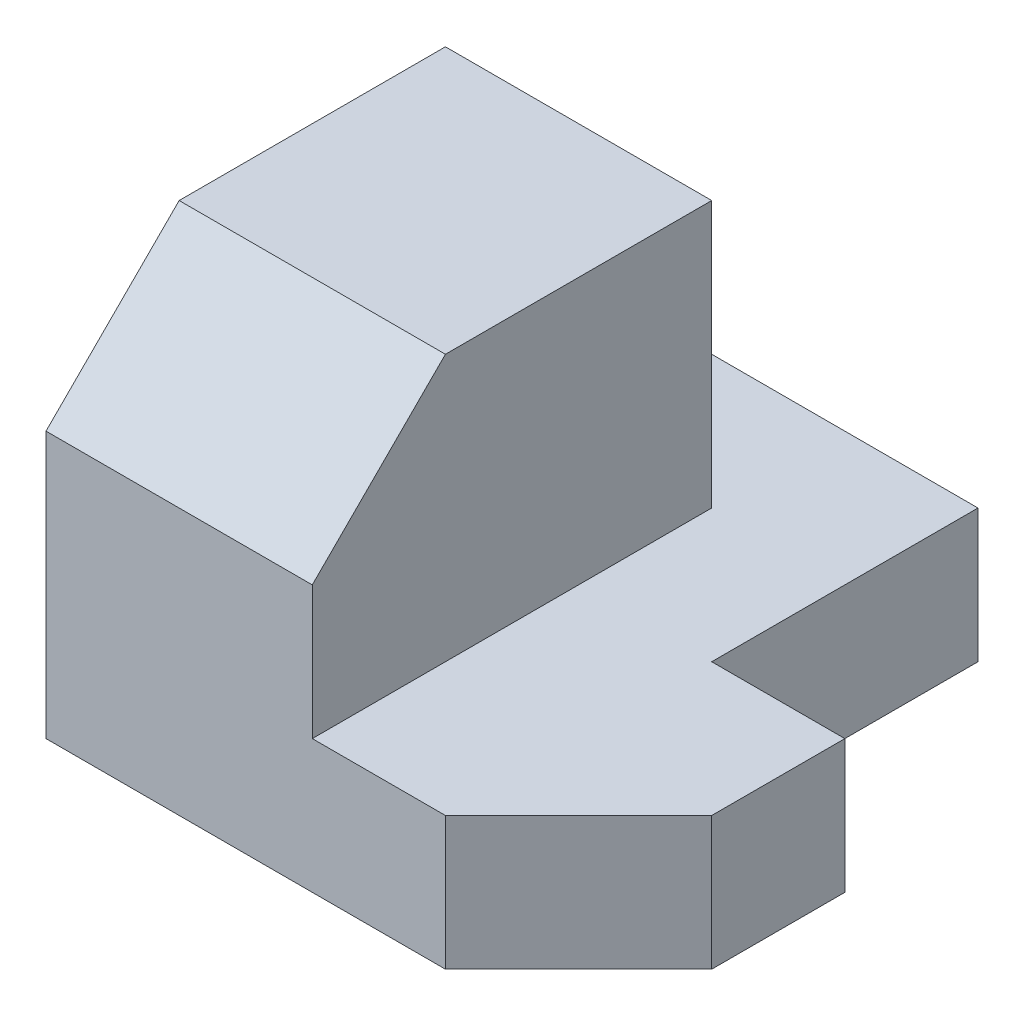
from build123d import *

# Parameters (mm, degrees)
EXTRUDE_1_DEPTH = 5
EXTRUDE_2_DEPTH = 10


with BuildPart() as part:
    # 草圖1 → 填料-伸長1 (new body)
    with BuildSketch(Plane(origin=(0, 0, 0), x_dir=(1, 0, 0), z_dir=(0, 1, 0))):
        Polygon((15, 20), (15, 10), (20, 10), (20, 5), (15, 0), (0, 0), (0, 20), align=None)
    extrude(amount=EXTRUDE_1_DEPTH)

    # 草圖2 → 填料-伸長2 (add)
    with BuildSketch(Plane.ZY):
        Polygon((-15, 5), (-15, 15), (-5, 15), (0, 10), (0, 5), align=None)
    extrude(amount=-EXTRUDE_2_DEPTH)


solid = part.part
